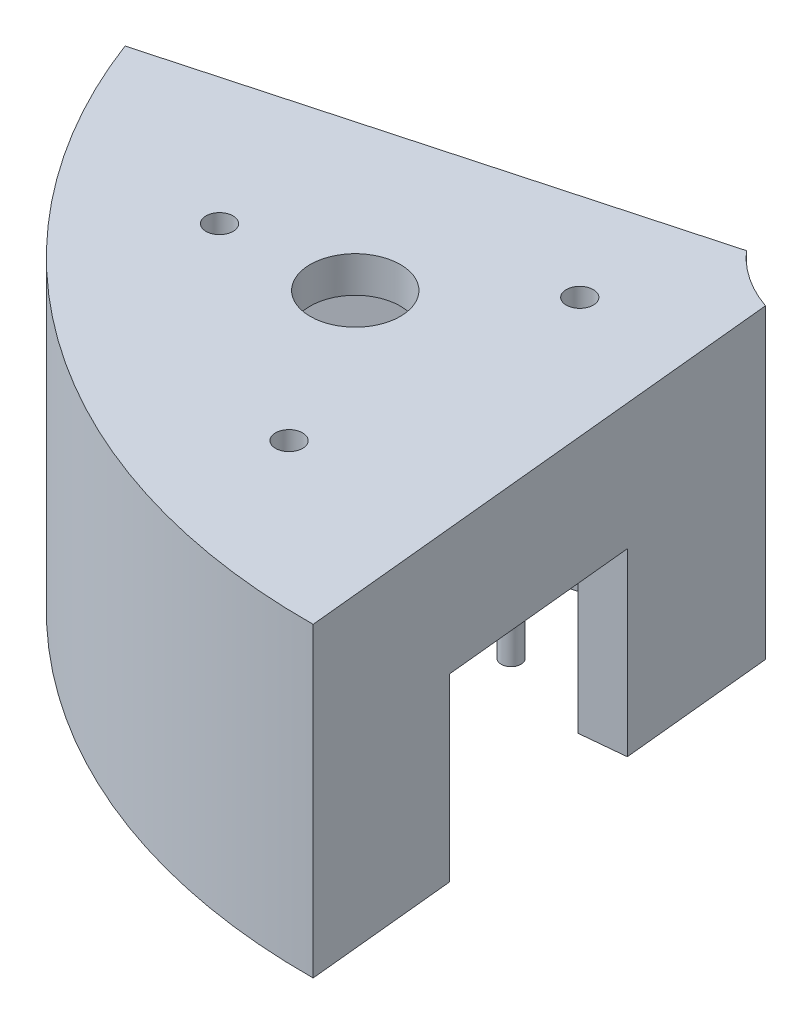
from build123d import *

# Parameters (mm, degrees)
BOSS_EXTRUDE1_DEPTH = 34
CUT_EXTRUDE1_DEPTH  = 30
SKETCH3_R           = 1.5
SKETCH3_R_2         = 5
CUT_EXTRUDE2_DEPTH  = 5
SKETCH4_W           = 22
SKETCH4_H           = 20
CUT_EXTRUDE3_DEPTH  = 6
SKETCH5_W           = 22
SKETCH5_H           = 20
CUT_EXTRUDE4_DEPTH  = 6
BOSS_EXTRUDE2_DEPTH = 10
SKETCH13_R          = 1.1
BOSS_EXTRUDE3_DEPTH = 10


with BuildPart() as part:
    # Sketch1 → Boss-Extrude1 (new body)
    with BuildSketch(Plane(origin=(0, 0, 0), x_dir=(1, 0, 0), z_dir=(0, 1, 0))):
        with BuildLine():
            Line((-76.081577676, -29.466634021), (-21.923666814, -14.650090384))
            ThreePointArc((-21.923666814, -14.650090384), (-19.017028504, -17.184879238), (-15.560151539, -18.894762991))
            Line((-15.560151539, -18.894762991), (-10.044056272, -74.622428409))
            ThreePointArc((-10.044056272, -74.622428409), (-50.159082361, -62.422374938), (-76.081577676, -29.466634021))
        make_face()
    extrude(amount=BOSS_EXTRUDE1_DEPTH)

    # Sketch2 → Cut-Extrude1 (cut)
    with BuildSketch(Plane.XZ):
        with BuildLine():
            Line((-15.616008473, 70.242360983), (-20.11040821, 23.685256516))
            ThreePointArc((-20.11040821, 23.685256516), (-22.281207254, 22.23411959), (-24.191874091, 20.454367051))
            Line((-24.191874091, 20.454367051), (-69.788119019, 33.047125828))
            ThreePointArc((-69.788119019, 33.047125828), (-47.337872486, 58.396456158), (-15.616008473, 70.242360983))
        make_face()
    extrude(amount=-CUT_EXTRUDE1_DEPTH, mode=Mode.SUBTRACT)

    # Sketch3 → Cut-Extrude2 (cut)
    with BuildSketch(Plane.XZ.offset(-30)):
        with Locations(Location((-26.678732616, 28.39195825, 0), (0, 0, 270))):
            Circle(SKETCH3_R)
        with Locations(Location((-53.760144922, 41.299208442, 0), (0, 0, 270))):
            Circle(SKETCH3_R)
        with Locations(Location((-29.04143221, 58.298774373, 0), (0, 0, 270))):
            Circle(SKETCH3_R)
        with Locations(Location((-39.804422608, 40.186637237, 0), (0, 0, 270))):
            Circle(SKETCH3_R_2)
    extrude(amount=-CUT_EXTRUDE2_DEPTH, mode=Mode.SUBTRACT)

    # Sketch4 → Cut-Extrude3 (cut)
    with BuildSketch(Plane(origin=(-22.190078988, 0, 2.142123878), x_dir=(0.09608851901557673, 0, 0.9953727927331515), z_dir=(-0.9953727927331515, 0, 0.09608851901557673))):
        with Locations((45.416815893, 10)):
            Rectangle(SKETCH4_W, SKETCH4_H)
    extrude(amount=-CUT_EXTRUDE3_DEPTH, mode=Mode.SUBTRACT)

    # Sketch5 → Cut-Extrude4 (cut)
    with BuildSketch(Plane(origin=(2.202244009, 0, 8.049713729), x_dir=(-0.9645546270217643, 0, 0.26388325352493547), z_dir=(-0.26388325352493547, 0, -0.9645546270217643))):
        with Locations((53.035036195, 10)):
            Rectangle(SKETCH5_W, SKETCH5_H)
    extrude(amount=-CUT_EXTRUDE4_DEPTH, mode=Mode.SUBTRACT)

    # Sketch10 → Boss-Extrude2 (add)
    with BuildSketch(Plane.XZ.offset(-30)):
        Polygon((-18.88301812, 36.399686031), (-16.769070701, 58.297887471), (-23.73668025, 58.970507104), (-25.850627669, 37.072305664), align=None)
        Polygon((-37.014944581, 23.995839242), (-58.221116276, 29.852554092), (-56.357621539, 36.599952655), (-35.151449843, 30.743237805), align=None)
    extrude(amount=BOSS_EXTRUDE2_DEPTH)

    # Sketch13 → Boss-Extrude3 (add)
    with BuildSketch(Plane.XZ.offset(-20)):
        with Locations(Location((-51.961198367, 29.679846926, 0), (0, 0, 90))):
            Circle(SKETCH13_R)
        with Locations(Location((-42.804014603, 27.150818354, 0), (0, 0, 90))):
            Circle(SKETCH13_R)
        with Locations(Location((-18.846348086, 52.390153669, 0), (0, 0, 90))):
            Circle(SKETCH13_R)
        with Locations(Location((-19.759189017, 42.934112138, 0), (0, 0, 90))):
            Circle(SKETCH13_R)
    extrude(amount=BOSS_EXTRUDE3_DEPTH)


solid = part.part
